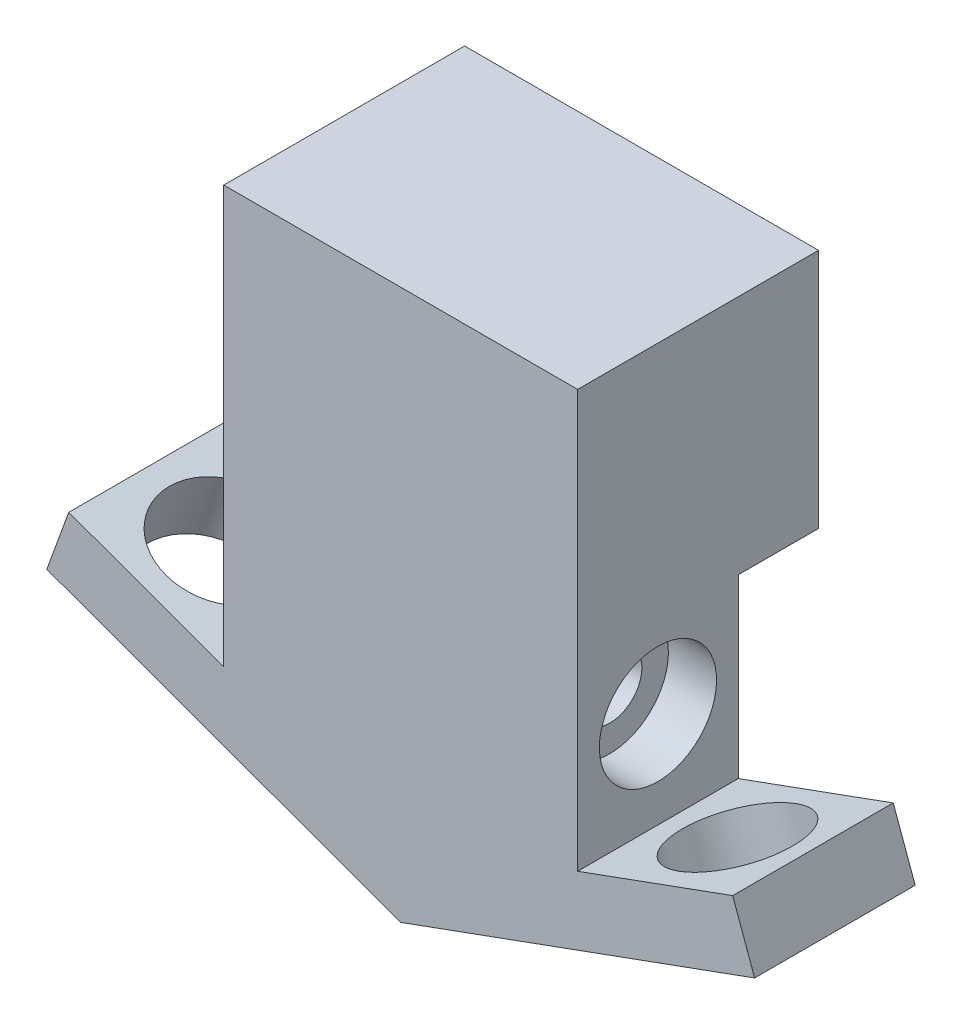
from build123d import *

# Parameters (mm, degrees)
BOSS_EXTRUDE1_DEPTH = 10
SKETCH2_R           = 3.65
CUT_EXTRUDE1_DEPTH  = 16.423609234
BOSS_EXTRUDE3_DEPTH = 10
SKETCH6_R           = 3.65
CUT_EXTRUDE4_DEPTH  = 3
SKETCH8_R           = 2
CUT_EXTRUDE5_DEPTH  = 16.041318231
SKETCH9_W           = 15
SKETCH9_H           = 15
BOSS_EXTRUDE4_DEPTH = 22.041318231


with BuildPart() as part:
    # Sketch1 → Boss-Extrude1 (new body)
    with BuildSketch(Plane.XY):
        Polygon((0, 0), (20.673237657, 7.524443153), (22.041318231, 3.76567267), (0, -4.25671109), (-22.041318231, 3.76567267), (-20.673237657, 7.524443153), align=None)
    extrude(amount=BOSS_EXTRUDE1_DEPTH)

    # Sketch2 → Cut-Extrude1 (cut)
    with BuildSketch(Plane(origin=(0, 0, 0), x_dir=(0.9396926207859093, 0.34202014332566627, 0), z_dir=(-0.34202014332566627, 0.9396926207859093, 0))):
        with Locations(Location((17, -5, 0), (0, 0, 180))):
            Circle(SKETCH2_R)
    cut_extrude1 = extrude(amount=-CUT_EXTRUDE1_DEPTH, mode=Mode.SUBTRACT)

    # Mirror1: Cut-Extrude1 across plane
    add(cut_extrude1.mirror(Plane(origin=(0, 0, 0), x_dir=(0, 0, 1), z_dir=(1, 0, 0))), mode=Mode.SUBTRACT)

    # Sketch3 → Boss-Extrude3 (add)
    with BuildSketch(Plane.XY.offset(10)):
        Polygon((0, -4.25671109), (-11.020659115, -0.24551921), (-11.020659115, 15), (11.020659115, 15), (11.020659115, -0.24551921), align=None)
    extrude(amount=-BOSS_EXTRUDE3_DEPTH)

    # Sketch6 → Cut-Extrude4 (cut)
    with BuildSketch(Plane(origin=(11.020659115, 0, 0), x_dir=(0, 0, -1), z_dir=(1, 0, 0))):
        with Locations(Location((-5, 10, 0), (0, 0, 90))):
            Circle(SKETCH6_R)
    cut_extrude4 = extrude(amount=-CUT_EXTRUDE4_DEPTH, mode=Mode.SUBTRACT)

    # Mirror3: Cut-Extrude4 across plane
    add(cut_extrude4.mirror(Plane(origin=(0, 0, 0), x_dir=(0, 0, 1), z_dir=(1, 0, 0))), mode=Mode.SUBTRACT)

    # Sketch8 → Cut-Extrude5 (cut)
    with BuildSketch(Plane.ZY.offset(8.020659115)):
        with Locations(Location((5, 10, 0), (0, 0, 270))):
            Circle(SKETCH8_R)
    extrude(amount=-CUT_EXTRUDE5_DEPTH, mode=Mode.SUBTRACT)

    # Sketch9 → Boss-Extrude4 (add)
    with BuildSketch(Plane.ZY.offset(11.020659115)):
        with Locations((2.5, 22.5)):
            Rectangle(SKETCH9_W, SKETCH9_H)
    extrude(amount=-BOSS_EXTRUDE4_DEPTH)


solid = part.part
